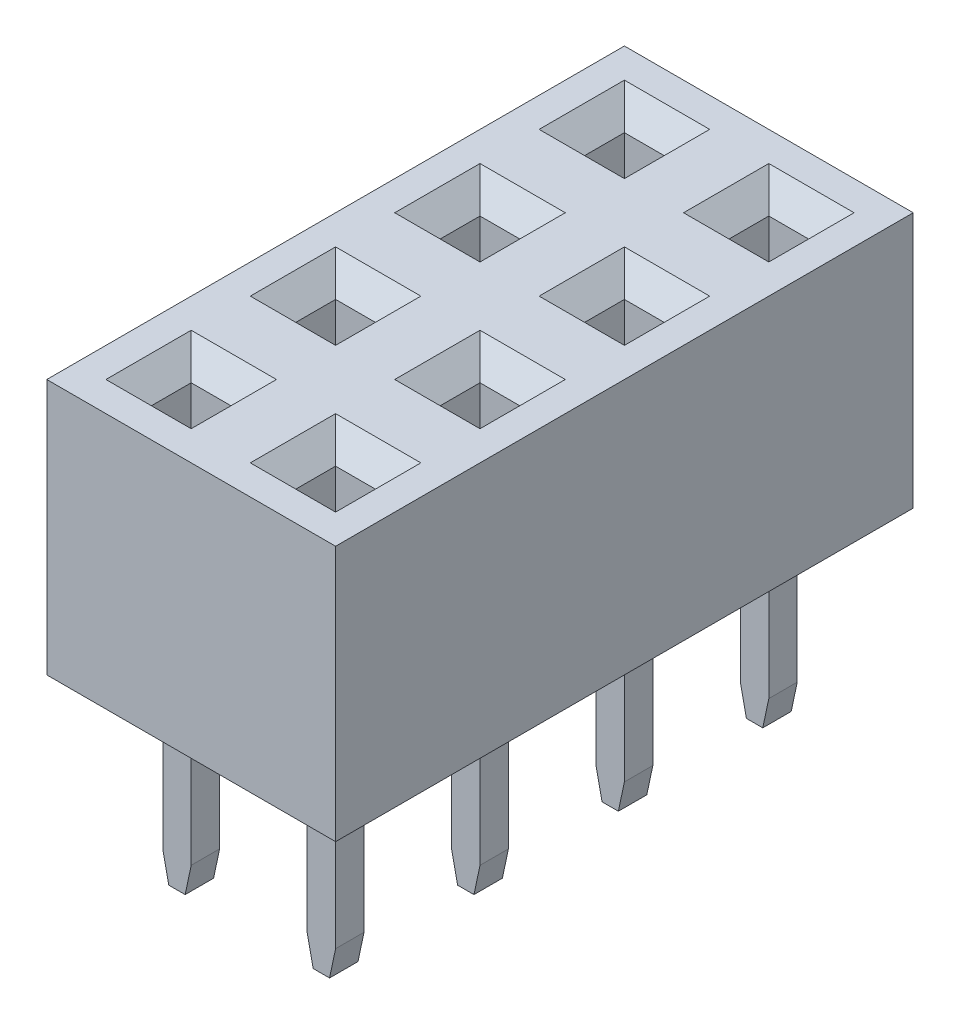
from build123d import *
from OCP.BRepFilletAPI import BRepFilletAPI_MakeChamfer

# Parameters (mm, degrees)
SKETCH_1_W                          = 2.54
SKETCH_1_H                          = 2.54
EXTRUDE_1_DEPTH                     = 4.5
SKETCH_4_W                          = 0.7
SKETCH_4_H                          = 0.7
CUT_EXTRUDE_1_DEPTH                 = 4.2
CHAMFER_3_SIZE                      = 0.4
SKETCH_2_W                          = 0.5
SKETCH_2_H                          = 0.5
EXTRUDE_2_DEPTH                     = 3.15
CHAMFER_2_SIZE                      = 0.5
CHAMFER_2_SIZE2                     = 0.106278281
PATTERN_LINEAR_1_COUNT              = 4
PATTERN_LINEAR_1_PITCH              = 2.54
PATTERN_LINEAR_1_COUNT_DIR2         = 2
PATTERN_LINEAR_1_PITCH_DIR2         = 2.54
CHAMFER_3_OF_PATTERN_LINEAR_1_SIZE  = 0.4
CHAMFER_2_OF_PATTERN_LINEAR_1_SIZE  = 0.5
CHAMFER_2_OF_PATTERN_LINEAR_1_SIZE2 = 0.106278281


with BuildPart() as part:
    # Эскиз1 → Бобышка-Вытянуть1 (new body)
    with BuildSketch(Plane(origin=(0, 0, 0), x_dir=(-1, 0, 0), z_dir=(0, 1, 0))):
        Rectangle(SKETCH_1_W, SKETCH_1_H)
    extrude_1 = extrude(amount=EXTRUDE_1_DEPTH)

    # Эскиз4 → Вырез-Вытянуть1 (cut)
    with BuildSketch(Plane(origin=(0, 4.5, 0), x_dir=(1, 0, 0), z_dir=(0, 1, 0))):
        Rectangle(SKETCH_4_W, SKETCH_4_H)
    cut_extrude_1 = extrude(amount=-CUT_EXTRUDE_1_DEPTH, mode=Mode.SUBTRACT)

    # Фаска3
    chamfer_3_edges = [part.edges().sort_by_distance(p)[0] for p in [
        (-0.35, 4.5, 0),
        (0, 4.5, 0.35),
        (0.35, 4.5, 0),
        (0, 4.5, -0.35),
    ]]
    chamfer(chamfer_3_edges, length=CHAMFER_3_SIZE)

    # Эскиз2 → Бобышка-Вытянуть2 (add)
    with BuildSketch(Plane(origin=(0, 0, 0), x_dir=(-1, 0, 0), z_dir=(0, 1, 0))):
        Rectangle(SKETCH_2_W, SKETCH_2_H)
    extrude_2 = extrude(amount=-EXTRUDE_2_DEPTH)

    # Фаска2: one chamfer whose edges measure the first distance from different faces: ONE call of the kernel's chamfer builder (chamfer() names one face for all edges)
    chamfer_2_edges_1 = [part.edges().sort_by_distance(p)[0] for p in [
        (-0.25, -3.15, 0),
    ]]
    chamfer_2_side_1 = [part.faces().sort_by_distance(p)[0] for p in [
        (-0.25, -1.575, 0),
    ]]
    chamfer_2_edges_2 = [part.edges().sort_by_distance(p)[0] for p in [
        (0.25, -3.15, 0),
    ]]
    chamfer_2_side_2 = [part.faces().sort_by_distance(p)[0] for p in [
        (0.25, -1.575, 0),
    ]]
    chamfer_2 = BRepFilletAPI_MakeChamfer(part.part.solid().wrapped)
    for e in chamfer_2_edges_1:
        chamfer_2.Add(CHAMFER_2_SIZE, CHAMFER_2_SIZE2, e.wrapped, chamfer_2_side_1[0].wrapped)  # the first distance lies on this face
    for e in chamfer_2_edges_2:
        chamfer_2.Add(CHAMFER_2_SIZE, CHAMFER_2_SIZE2, e.wrapped, chamfer_2_side_2[0].wrapped)  # the first distance lies on this face
    add(Compound.cast(chamfer_2.Shape()), mode=Mode.REPLACE)

    # Линейный массив1: Бобышка-Вытянуть1, Вырез-Вытянуть1, Extrude 2 4 × 2
    with Locations(*[(-j * PATTERN_LINEAR_1_PITCH_DIR2, 0, -i * PATTERN_LINEAR_1_PITCH) for i in range(PATTERN_LINEAR_1_COUNT) for j in range(PATTERN_LINEAR_1_COUNT_DIR2) if (i, j) != (0, 0)]):
        add(extrude_1)
        add(cut_extrude_1, mode=Mode.SUBTRACT)
        add(extrude_2)

    # Фаска3 of Линейный массив1
    chamfer_3_of_pattern_linear_1_edges = [part.edges().sort_by_distance(p)[0] for p in [
        (-2.89, 4.5, 0),
        (-2.54, 4.5, 0.35),
        (-2.19, 4.5, 0),
        (-2.54, 4.5, -0.35),
        (-0.35, 4.5, -2.54),
        (0, 4.5, -2.19),
        (0.35, 4.5, -2.54),
        (0, 4.5, -2.89),
        (-2.89, 4.5, -2.54),
        (-2.54, 4.5, -2.19),
        (-2.19, 4.5, -2.54),
        (-2.54, 4.5, -2.89),
        (-0.35, 4.5, -5.08),
        (0, 4.5, -4.73),
        (0.35, 4.5, -5.08),
        (0, 4.5, -5.43),
        (-2.89, 4.5, -5.08),
        (-2.54, 4.5, -4.73),
        (-2.19, 4.5, -5.08),
        (-2.54, 4.5, -5.43),
        (-0.35, 4.5, -7.62),
        (0, 4.5, -7.27),
        (0.35, 4.5, -7.62),
        (0, 4.5, -7.97),
        (-2.89, 4.5, -7.62),
        (-2.54, 4.5, -7.27),
        (-2.19, 4.5, -7.62),
        (-2.54, 4.5, -7.97),
    ]]
    chamfer(chamfer_3_of_pattern_linear_1_edges, length=CHAMFER_3_OF_PATTERN_LINEAR_1_SIZE)

    # Фаска2 of Линейный массив1: one chamfer whose edges measure the first distance from different faces: ONE call of the kernel's chamfer builder (chamfer() names one face for all edges)
    chamfer_2_of_pattern_linear_1_edges_1 = [part.edges().sort_by_distance(p)[0] for p in [
        (-2.79, -3.15, 0),
    ]]
    chamfer_2_of_pattern_linear_1_side_1 = [part.faces().sort_by_distance(p)[0] for p in [
        (-2.79, -1.575, 0),
    ]]
    chamfer_2_of_pattern_linear_1_edges_2 = [part.edges().sort_by_distance(p)[0] for p in [
        (-2.29, -3.15, 0),
    ]]
    chamfer_2_of_pattern_linear_1_side_2 = [part.faces().sort_by_distance(p)[0] for p in [
        (-2.29, -1.575, 0),
    ]]
    chamfer_2_of_pattern_linear_1_edges_3 = [part.edges().sort_by_distance(p)[0] for p in [
        (-0.25, -3.15, -2.54),
    ]]
    chamfer_2_of_pattern_linear_1_side_3 = [part.faces().sort_by_distance(p)[0] for p in [
        (-0.25, -1.575, -2.54),
    ]]
    chamfer_2_of_pattern_linear_1_edges_4 = [part.edges().sort_by_distance(p)[0] for p in [
        (0.25, -3.15, -2.54),
    ]]
    chamfer_2_of_pattern_linear_1_side_4 = [part.faces().sort_by_distance(p)[0] for p in [
        (0.25, -1.575, -2.54),
    ]]
    chamfer_2_of_pattern_linear_1_edges_5 = [part.edges().sort_by_distance(p)[0] for p in [
        (-2.79, -3.15, -2.54),
    ]]
    chamfer_2_of_pattern_linear_1_side_5 = [part.faces().sort_by_distance(p)[0] for p in [
        (-2.79, -1.575, -2.54),
    ]]
    chamfer_2_of_pattern_linear_1_edges_6 = [part.edges().sort_by_distance(p)[0] for p in [
        (-2.29, -3.15, -2.54),
    ]]
    chamfer_2_of_pattern_linear_1_side_6 = [part.faces().sort_by_distance(p)[0] for p in [
        (-2.29, -1.575, -2.54),
    ]]
    chamfer_2_of_pattern_linear_1_edges_7 = [part.edges().sort_by_distance(p)[0] for p in [
        (-0.25, -3.15, -5.08),
    ]]
    chamfer_2_of_pattern_linear_1_side_7 = [part.faces().sort_by_distance(p)[0] for p in [
        (-0.25, -1.575, -5.08),
    ]]
    chamfer_2_of_pattern_linear_1_edges_8 = [part.edges().sort_by_distance(p)[0] for p in [
        (0.25, -3.15, -5.08),
    ]]
    chamfer_2_of_pattern_linear_1_side_8 = [part.faces().sort_by_distance(p)[0] for p in [
        (0.25, -1.575, -5.08),
    ]]
    chamfer_2_of_pattern_linear_1_edges_9 = [part.edges().sort_by_distance(p)[0] for p in [
        (-2.79, -3.15, -5.08),
    ]]
    chamfer_2_of_pattern_linear_1_side_9 = [part.faces().sort_by_distance(p)[0] for p in [
        (-2.79, -1.575, -5.08),
    ]]
    chamfer_2_of_pattern_linear_1_edges_10 = [part.edges().sort_by_distance(p)[0] for p in [
        (-2.29, -3.15, -5.08),
    ]]
    chamfer_2_of_pattern_linear_1_side_10 = [part.faces().sort_by_distance(p)[0] for p in [
        (-2.29, -1.575, -5.08),
    ]]
    chamfer_2_of_pattern_linear_1_edges_11 = [part.edges().sort_by_distance(p)[0] for p in [
        (-0.25, -3.15, -7.62),
    ]]
    chamfer_2_of_pattern_linear_1_side_11 = [part.faces().sort_by_distance(p)[0] for p in [
        (-0.25, -1.575, -7.62),
    ]]
    chamfer_2_of_pattern_linear_1_edges_12 = [part.edges().sort_by_distance(p)[0] for p in [
        (0.25, -3.15, -7.62),
    ]]
    chamfer_2_of_pattern_linear_1_side_12 = [part.faces().sort_by_distance(p)[0] for p in [
        (0.25, -1.575, -7.62),
    ]]
    chamfer_2_of_pattern_linear_1_edges_13 = [part.edges().sort_by_distance(p)[0] for p in [
        (-2.79, -3.15, -7.62),
    ]]
    chamfer_2_of_pattern_linear_1_side_13 = [part.faces().sort_by_distance(p)[0] for p in [
        (-2.79, -1.575, -7.62),
    ]]
    chamfer_2_of_pattern_linear_1_edges_14 = [part.edges().sort_by_distance(p)[0] for p in [
        (-2.29, -3.15, -7.62),
    ]]
    chamfer_2_of_pattern_linear_1_side_14 = [part.faces().sort_by_distance(p)[0] for p in [
        (-2.29, -1.575, -7.62),
    ]]
    chamfer_2_of_pattern_linear_1 = BRepFilletAPI_MakeChamfer(part.part.solid().wrapped)
    for e in chamfer_2_of_pattern_linear_1_edges_1:
        chamfer_2_of_pattern_linear_1.Add(CHAMFER_2_OF_PATTERN_LINEAR_1_SIZE, CHAMFER_2_OF_PATTERN_LINEAR_1_SIZE2, e.wrapped, chamfer_2_of_pattern_linear_1_side_1[0].wrapped)  # the first distance lies on this face
    for e in chamfer_2_of_pattern_linear_1_edges_2:
        chamfer_2_of_pattern_linear_1.Add(CHAMFER_2_OF_PATTERN_LINEAR_1_SIZE, CHAMFER_2_OF_PATTERN_LINEAR_1_SIZE2, e.wrapped, chamfer_2_of_pattern_linear_1_side_2[0].wrapped)  # the first distance lies on this face
    for e in chamfer_2_of_pattern_linear_1_edges_3:
        chamfer_2_of_pattern_linear_1.Add(CHAMFER_2_OF_PATTERN_LINEAR_1_SIZE, CHAMFER_2_OF_PATTERN_LINEAR_1_SIZE2, e.wrapped, chamfer_2_of_pattern_linear_1_side_3[0].wrapped)  # the first distance lies on this face
    for e in chamfer_2_of_pattern_linear_1_edges_4:
        chamfer_2_of_pattern_linear_1.Add(CHAMFER_2_OF_PATTERN_LINEAR_1_SIZE, CHAMFER_2_OF_PATTERN_LINEAR_1_SIZE2, e.wrapped, chamfer_2_of_pattern_linear_1_side_4[0].wrapped)  # the first distance lies on this face
    for e in chamfer_2_of_pattern_linear_1_edges_5:
        chamfer_2_of_pattern_linear_1.Add(CHAMFER_2_OF_PATTERN_LINEAR_1_SIZE, CHAMFER_2_OF_PATTERN_LINEAR_1_SIZE2, e.wrapped, chamfer_2_of_pattern_linear_1_side_5[0].wrapped)  # the first distance lies on this face
    for e in chamfer_2_of_pattern_linear_1_edges_6:
        chamfer_2_of_pattern_linear_1.Add(CHAMFER_2_OF_PATTERN_LINEAR_1_SIZE, CHAMFER_2_OF_PATTERN_LINEAR_1_SIZE2, e.wrapped, chamfer_2_of_pattern_linear_1_side_6[0].wrapped)  # the first distance lies on this face
    for e in chamfer_2_of_pattern_linear_1_edges_7:
        chamfer_2_of_pattern_linear_1.Add(CHAMFER_2_OF_PATTERN_LINEAR_1_SIZE, CHAMFER_2_OF_PATTERN_LINEAR_1_SIZE2, e.wrapped, chamfer_2_of_pattern_linear_1_side_7[0].wrapped)  # the first distance lies on this face
    for e in chamfer_2_of_pattern_linear_1_edges_8:
        chamfer_2_of_pattern_linear_1.Add(CHAMFER_2_OF_PATTERN_LINEAR_1_SIZE, CHAMFER_2_OF_PATTERN_LINEAR_1_SIZE2, e.wrapped, chamfer_2_of_pattern_linear_1_side_8[0].wrapped)  # the first distance lies on this face
    for e in chamfer_2_of_pattern_linear_1_edges_9:
        chamfer_2_of_pattern_linear_1.Add(CHAMFER_2_OF_PATTERN_LINEAR_1_SIZE, CHAMFER_2_OF_PATTERN_LINEAR_1_SIZE2, e.wrapped, chamfer_2_of_pattern_linear_1_side_9[0].wrapped)  # the first distance lies on this face
    for e in chamfer_2_of_pattern_linear_1_edges_10:
        chamfer_2_of_pattern_linear_1.Add(CHAMFER_2_OF_PATTERN_LINEAR_1_SIZE, CHAMFER_2_OF_PATTERN_LINEAR_1_SIZE2, e.wrapped, chamfer_2_of_pattern_linear_1_side_10[0].wrapped)  # the first distance lies on this face
    for e in chamfer_2_of_pattern_linear_1_edges_11:
        chamfer_2_of_pattern_linear_1.Add(CHAMFER_2_OF_PATTERN_LINEAR_1_SIZE, CHAMFER_2_OF_PATTERN_LINEAR_1_SIZE2, e.wrapped, chamfer_2_of_pattern_linear_1_side_11[0].wrapped)  # the first distance lies on this face
    for e in chamfer_2_of_pattern_linear_1_edges_12:
        chamfer_2_of_pattern_linear_1.Add(CHAMFER_2_OF_PATTERN_LINEAR_1_SIZE, CHAMFER_2_OF_PATTERN_LINEAR_1_SIZE2, e.wrapped, chamfer_2_of_pattern_linear_1_side_12[0].wrapped)  # the first distance lies on this face
    for e in chamfer_2_of_pattern_linear_1_edges_13:
        chamfer_2_of_pattern_linear_1.Add(CHAMFER_2_OF_PATTERN_LINEAR_1_SIZE, CHAMFER_2_OF_PATTERN_LINEAR_1_SIZE2, e.wrapped, chamfer_2_of_pattern_linear_1_side_13[0].wrapped)  # the first distance lies on this face
    for e in chamfer_2_of_pattern_linear_1_edges_14:
        chamfer_2_of_pattern_linear_1.Add(CHAMFER_2_OF_PATTERN_LINEAR_1_SIZE, CHAMFER_2_OF_PATTERN_LINEAR_1_SIZE2, e.wrapped, chamfer_2_of_pattern_linear_1_side_14[0].wrapped)  # the first distance lies on this face
    add(Compound.cast(chamfer_2_of_pattern_linear_1.Shape()), mode=Mode.REPLACE)


solid = part.part
